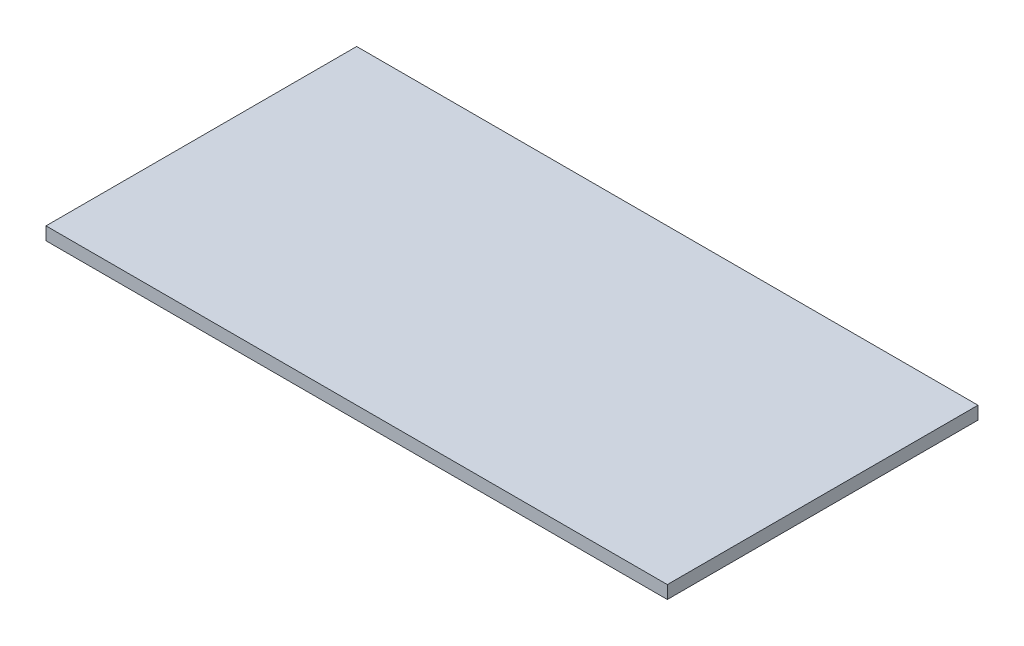
from build123d import *

# Parameters (mm, degrees)
SKETCH1_W           = 609.6
SKETCH1_H           = 304.8
BOSS_EXTRUDE1_DEPTH = 12.7


with BuildPart() as part:
    # Sketch1 → Boss-Extrude1 (new body)
    with BuildSketch(Plane(origin=(0, 0, 0), x_dir=(1, 0, 0), z_dir=(0, 1, 0))):
        with Locations((304.8, 152.4)):
            Rectangle(SKETCH1_W, SKETCH1_H)
    extrude(amount=BOSS_EXTRUDE1_DEPTH)


solid = part.part
